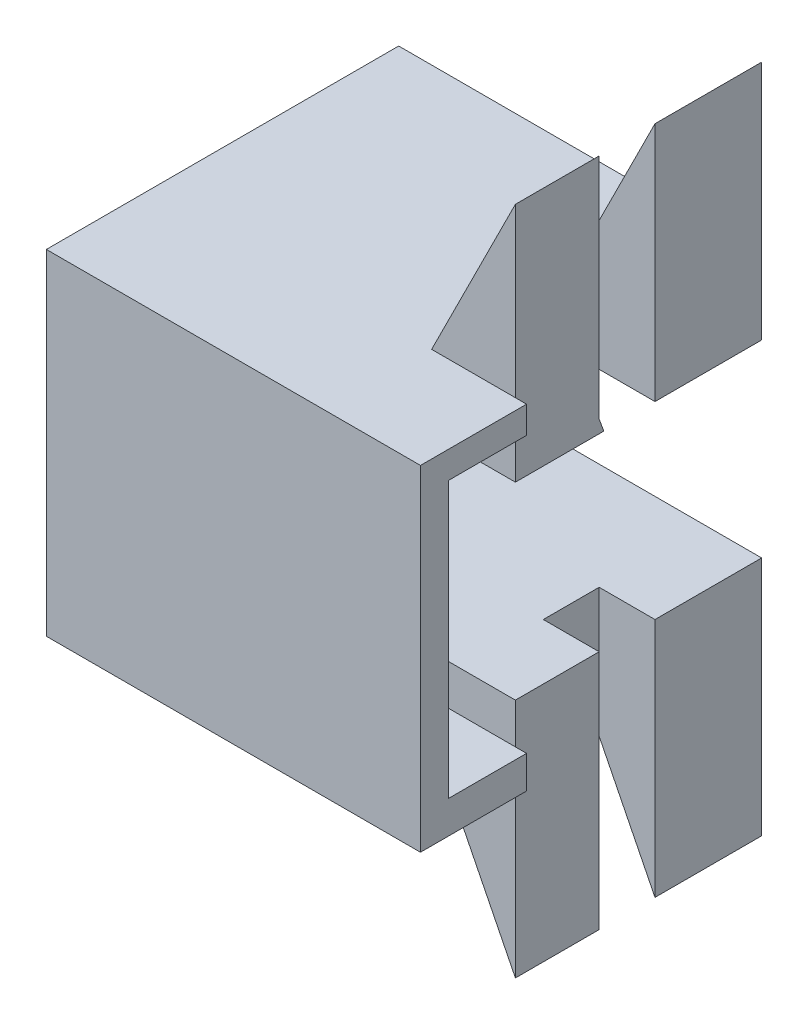
from build123d import *

# Parameters (mm, degrees)
SKETCH_1_W          = 50
SKETCH_1_H          = 60
EXTRUDE_1_DEPTH     = 44.1
SKETCH_2_W          = 113
SKETCH_2_H          = 33.8
CUT_EXTRUDE_1_DEPTH = 120.456310005
CUT_EXTRUDE_2_DEPTH = 10
EXTRUDE_2_DEPTH     = 14
SKETCH_5_W          = 67
SKETCH_5_H          = 60
EXTRUDE_3_DEPTH     = 5


with BuildPart() as part:
    # 草图1 → 凸台-拉伸1 (new body)
    with BuildSketch(Plane.XY):
        with Locations((25, -30)):
            Rectangle(SKETCH_1_W, SKETCH_1_H)
        Polygon((50, 0), (50, -30), (65, -30), (65, 30), align=None)
        Polygon((65, -30), (50, -30), (50, -60), (65, -90), align=None)
    extrude(amount=EXTRUDE_1_DEPTH)

    # 草图2 → 切除-拉伸1 (cut, through all)
    with BuildSketch(Plane.XY.offset(44.1)):
        with Locations((65, -30)):
            Rectangle(SKETCH_2_W, SKETCH_2_H)
    extrude(amount=-CUT_EXTRUDE_1_DEPTH, mode=Mode.SUBTRACT)

    # 草图3 → 切除-拉伸2 (cut)
    with BuildSketch(Plane(origin=(65, 0, 0), x_dir=(0, 0, -1), z_dir=(1, 0, 0))):
        Polygon((-19.1, -38.027210884), (-28.26075, -13.1), (-29.1, -13.1), (-29.1, -90), (-19.1, -90), align=None)
        Polygon((-29.1, 30), (-29.1, -10.816326531), (-28.26075, -13.1), (-19.1, -13.1), (-19.1, 30), align=None)
    extrude(amount=-CUT_EXTRUDE_2_DEPTH, mode=Mode.SUBTRACT)

    # 草图4 → 凸台-拉伸2 (add)
    with BuildSketch(Plane.XY.offset(44.1)):
        Polygon((0, 0), (0, -60), (67, -60), (67, -54.158468487), (28.5, -54.158468487), (28.5, -4.836475325), (67, -4.836475325), (67, 0), align=None)
    extrude(amount=EXTRUDE_2_DEPTH)

    # 草图5 → 凸台-拉伸3 (add)
    with BuildSketch(Plane.XY.offset(58.1)):
        with Locations((33.5, -30)):
            Rectangle(SKETCH_5_W, SKETCH_5_H)
    extrude(amount=EXTRUDE_3_DEPTH)


solid = part.part
